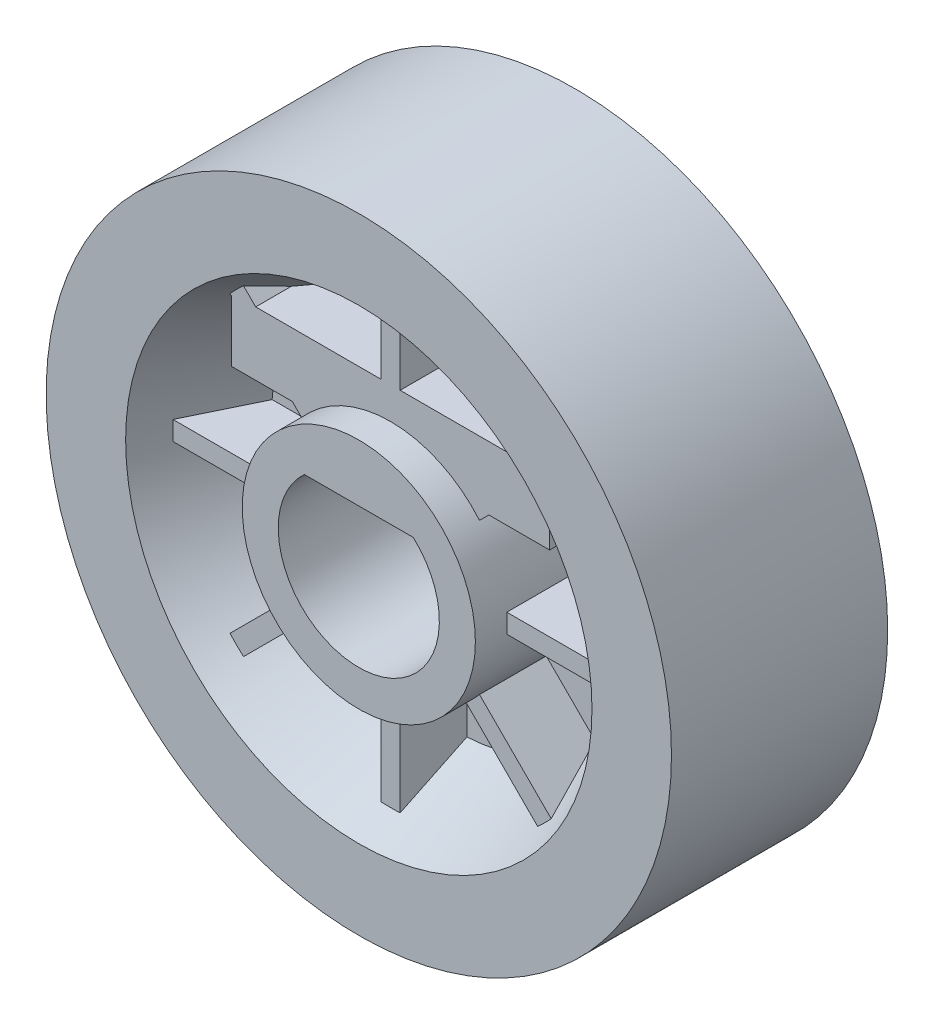
from build123d import *

# Parameters (mm, degrees)
SKETCH_2_R          = 5
CUT_EXTRUDE_1_DEPTH = 47.439853574
SKETCH_3_W          = 1.8
SKETCH_3_H          = 18
SKETCH_3_W_2        = 18
SKETCH_3_H_2        = 1.8
EXTRUDE_1_DEPTH     = 15
SKETCH_4_W          = 30
SKETCH_4_H          = 6
EXTRUDE_2_DEPTH     = 15
SCALE_1_SCALE       = 1.01


with BuildPart() as part:
    # Эскиз1 → Повернуть1 (revolve)
    with BuildSketch(Plane(origin=(0, 0, 0), x_dir=(1, 0, 0), z_dir=(0, 1, 0)), mode=Mode.PRIVATE) as revolve_1_sk:
        Polygon((-5, 0), (-11, 0), (-11, 9.3), (-17.5, 9.3), (-22, 0), (-29.5, 0), (-29.5, 20.4), (-22, 20.4), (-17.5, 11.1), (-11, 11.1), (-11, 20.4), (-5, 20.4), align=None)
    revolve(revolve_1_sk.sketch.rotate(Axis((0, 0, 0), (0, 0, -1)), 180), axis=Axis((0, 0, 0), (0, 0, -1)))

    # Эскиз2 → Вырез-Вытянуть1 (cut, through all)
    with BuildSketch(Plane.XY):
        with BuildLine():
            Line((5.138093031, 5.6), (-5.138093031, 5.6))
            ThreePointArc((-5.138093031, 5.6), (-3.058634741, -6.957352479), (7.6, 0))
            ThreePointArc((7.6, 0), (6.957352479, 3.058634741), (5.138093031, 5.6))
        make_face()
        Circle(SKETCH_2_R, mode=Mode.SUBTRACT)
    extrude(amount=-CUT_EXTRUDE_1_DEPTH, mode=Mode.SUBTRACT)

    # Эскиз3 → Бобышка-Вытянуть1 (add)
    with BuildSketch(Plane.XY.offset(-3)):
        Polygon((5.020458146, 6.293250353), (6.293250353, 5.020458146), (19.021172414, 17.748380208), (17.748380208, 19.021172414), align=None)
        with Locations((0, 17)):
            Rectangle(SKETCH_3_W, SKETCH_3_H)
        with Locations((17, 0)):
            Rectangle(SKETCH_3_W_2, SKETCH_3_H_2)
        Polygon((6.293250353, -5.020458146), (5.020458146, -6.293250353), (17.748380208, -19.021172414), (19.021172414, -17.748380208), align=None)
        with Locations((0, -17)):
            Rectangle(SKETCH_3_W, SKETCH_3_H)
        Polygon((-5.020458146, -6.293250353), (-6.293250353, -5.020458146), (-19.021172414, -17.748380208), (-17.748380208, -19.021172414), align=None)
        with Locations((-17, 0)):
            Rectangle(SKETCH_3_W_2, SKETCH_3_H_2)
        Polygon((-6.293250353, 5.020458146), (-5.020458146, 6.293250353), (-17.748380208, 19.021172414), (-19.021172414, 17.748380208), align=None)
    extrude(amount=-EXTRUDE_1_DEPTH)

    # Эскиз4 → Бобышка-Вытянуть2 (add)
    with BuildSketch(Plane.XY.offset(-3)):
        with Locations((0, 11)):
            Rectangle(SKETCH_4_W, SKETCH_4_H)
    extrude(amount=-EXTRUDE_2_DEPTH)


with BuildPart() as part_1:
    # Масштаб1: scaled about (0, 0.46627192, -10.228796233)
    add(part.part.scale(SCALE_1_SCALE).moved(Location((0, -0.004662719, 0.102287962))))


solid = part_1.part
